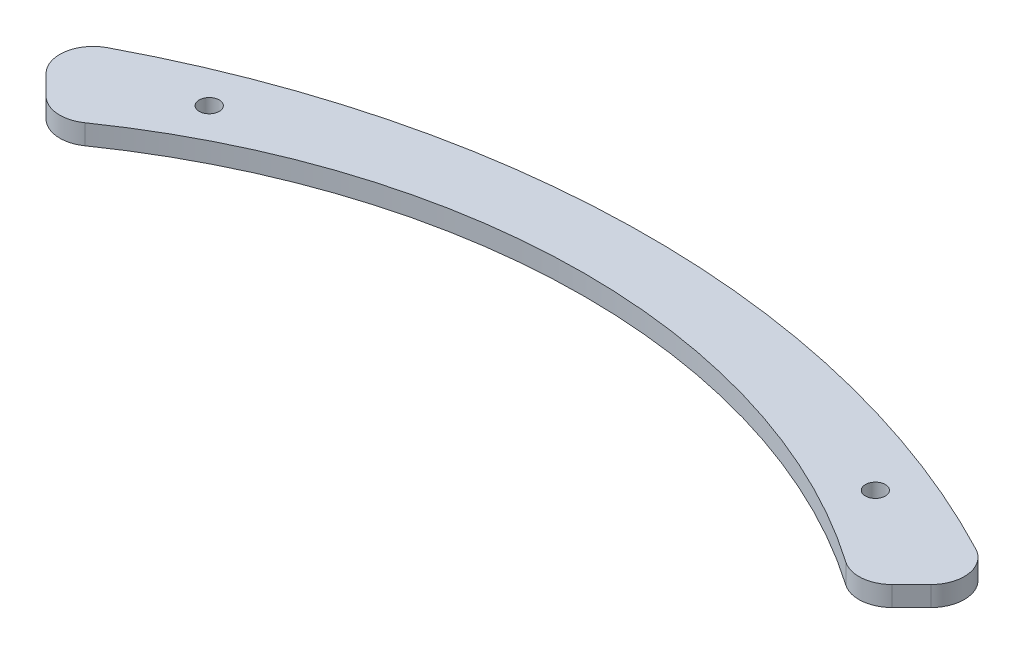
from build123d import *

# Parameters (mm, degrees)
BOSS_EXTRUDE1_DEPTH = 3
FILLET1_R           = 5
CUT_EXTRUDE1_REACH  = 157.621
SKETCH2_R           = 1.5


with BuildPart() as part:
    # Sketch1 → Boss-Extrude1 (new body)
    with BuildSketch(Plane(origin=(0, 0, 0), x_dir=(1, 0, 0), z_dir=(0, 1, 0))):
        with BuildLine():
            Line((-71.102710222, 120.600184905), (-60.496108504, 109.993583187))
            ThreePointArc((-60.496108504, 109.993583187), (0, 130.368079384), (60.496108504, 109.993583187))
            Line((60.496108504, 109.993583187), (71.102710222, 120.600184905))
            ThreePointArc((71.102710222, 120.600184905), (0, 140), (-71.102710222, 120.600184905))
        make_face()
    extrude(amount=BOSS_EXTRUDE1_DEPTH)

    # Fillet1
    fillet1_edges = [part.edges().sort_by_distance(p)[0] for p in [
        (71.102710222, 1.5, -120.600184905),
        (60.496108504, 1.5, -109.993583187),
        (-60.496108504, 1.5, -109.993583187),
        (-71.102710222, 1.5, -120.600184905),
    ]]
    fillet(fillet1_edges, radius=FILLET1_R)

    # Sketch2 → Cut-Extrude1 (cut, up to next)
    with BuildSketch(Plane(origin=(0, 3, 0), x_dir=(1, 0, 0), z_dir=(0, 1, 0)), mode=Mode.PRIVATE) as cut_extrude1_sk1:
        with Locations(Location((-50, 124, 0), (0, 0, 270))):
            Circle(SKETCH2_R)
    cut_extrude1_tool1 = extrude(cut_extrude1_sk1.sketch, amount=-CUT_EXTRUDE1_REACH, mode=Mode.PRIVATE) & part.part
    # Sketch2 → Cut-Extrude1 (cut, up to next)
    with BuildSketch(Plane(origin=(0, 3, 0), x_dir=(1, 0, 0), z_dir=(0, 1, 0)), mode=Mode.PRIVATE) as cut_extrude1_sk2:
        with Locations(Location((50, 124, 0), (0, 0, 270))):
            Circle(SKETCH2_R)
    cut_extrude1_tool2 = extrude(cut_extrude1_sk2.sketch, amount=-CUT_EXTRUDE1_REACH, mode=Mode.PRIVATE) & part.part
    add(cut_extrude1_tool1.solids().sort_by_distance((-50, 3, -124))[0], mode=Mode.SUBTRACT)
    add(cut_extrude1_tool2.solids().sort_by_distance((50, 3, -124))[0], mode=Mode.SUBTRACT)


solid = part.part
